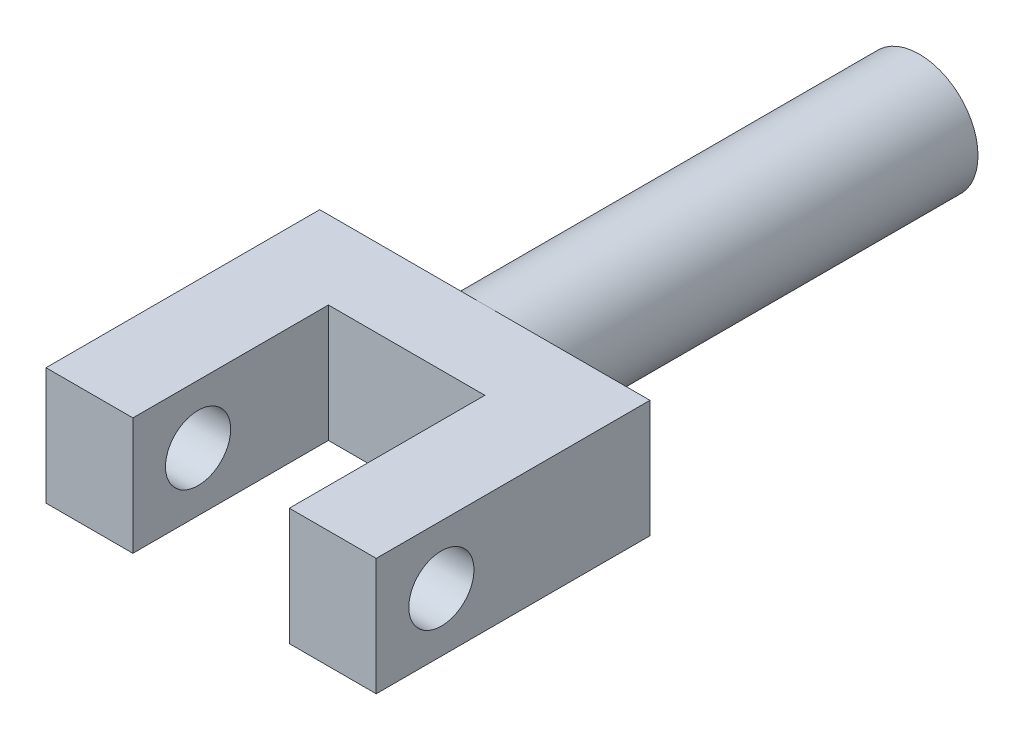
from build123d import *

# Parameters (mm, degrees)
SKETCH1_R                = 1.35
BOSS_EXTRUDE1_DEPTH      = 10
BOSS_EXTRUDE5_DEPTH      = 1.35
BOSS_EXTRUDE5_DEPTH_BACK = 1.35
CUT_EXTRUDE1_DEPTH       = 11.25
CUT_EXTRUDE1_DEPTH_BACK  = 11.25
SKETCH4_R                = 0.75


with BuildPart() as part:
    # Sketch1 → Boss-Extrude1 (new body)
    with BuildSketch(Plane.XY):
        Circle(SKETCH1_R)
    extrude(amount=BOSS_EXTRUDE1_DEPTH)

    # Sketch3 → Boss-Extrude5 (add, two sides: drawn at the far end of the back side and taken through both)
    with BuildSketch(Plane(origin=(0, 0, 0), x_dir=(1, 0, 0), z_dir=(0, 1, 0)).offset(-BOSS_EXTRUDE5_DEPTH_BACK)):
        Polygon((0, -10), (-3.8, -10), (-3.8, -16.3), (-1.8, -16.3), (-1.8, -11.8), (1.8, -11.8), (1.8, -16.3), (3.8, -16.3), (3.8, -10), align=None)
    extrude(amount=BOSS_EXTRUDE5_DEPTH + BOSS_EXTRUDE5_DEPTH_BACK)

    # Sketch4 → Cut-Extrude1 (cut, two sides: drawn at the far end of the back side and taken through both)
    with BuildSketch(Plane(origin=(-1.8, 0, 0), x_dir=(0, 0, -1), z_dir=(1, 0, 0)).offset(-CUT_EXTRUDE1_DEPTH_BACK)):
        with Locations((-14.8, 0)):
            Circle(SKETCH4_R)
    extrude(amount=CUT_EXTRUDE1_DEPTH + CUT_EXTRUDE1_DEPTH_BACK, mode=Mode.SUBTRACT)


solid = part.part
